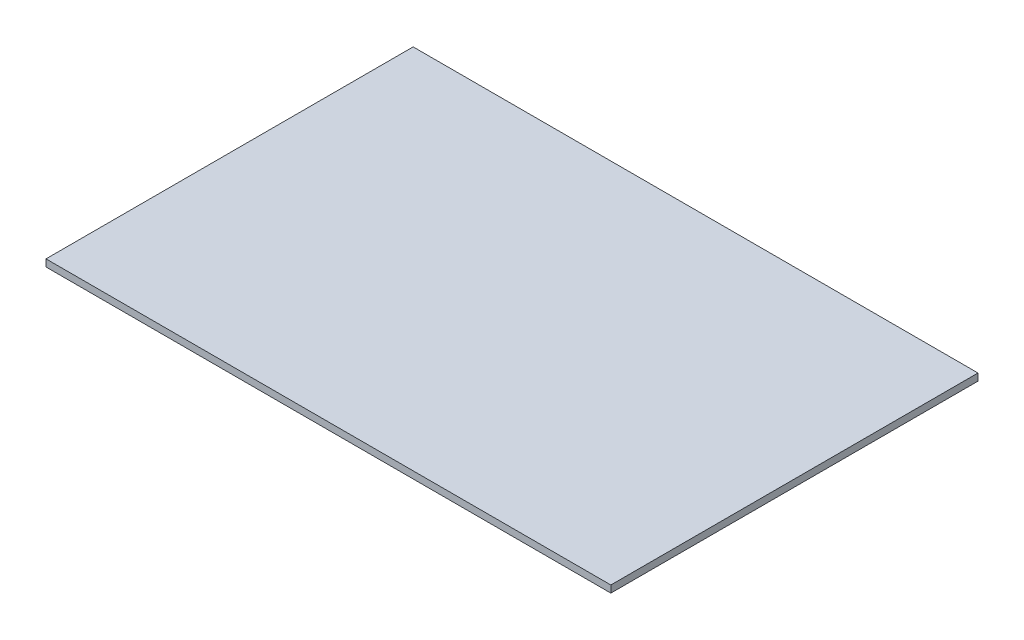
from build123d import *

# Parameters (mm, degrees)
SKETCH1_W           = 120
SKETCH1_H           = 78
BOSS_EXTRUDE1_DEPTH = 1.5


with BuildPart() as part:
    # Sketch1 → Boss-Extrude1 (new body)
    with BuildSketch(Plane(origin=(0, 0, 0), x_dir=(1, 0, 0), z_dir=(0, 1, 0))):
        with Locations((60, 39)):
            Rectangle(SKETCH1_W, SKETCH1_H)
    extrude(amount=BOSS_EXTRUDE1_DEPTH)


solid = part.part
